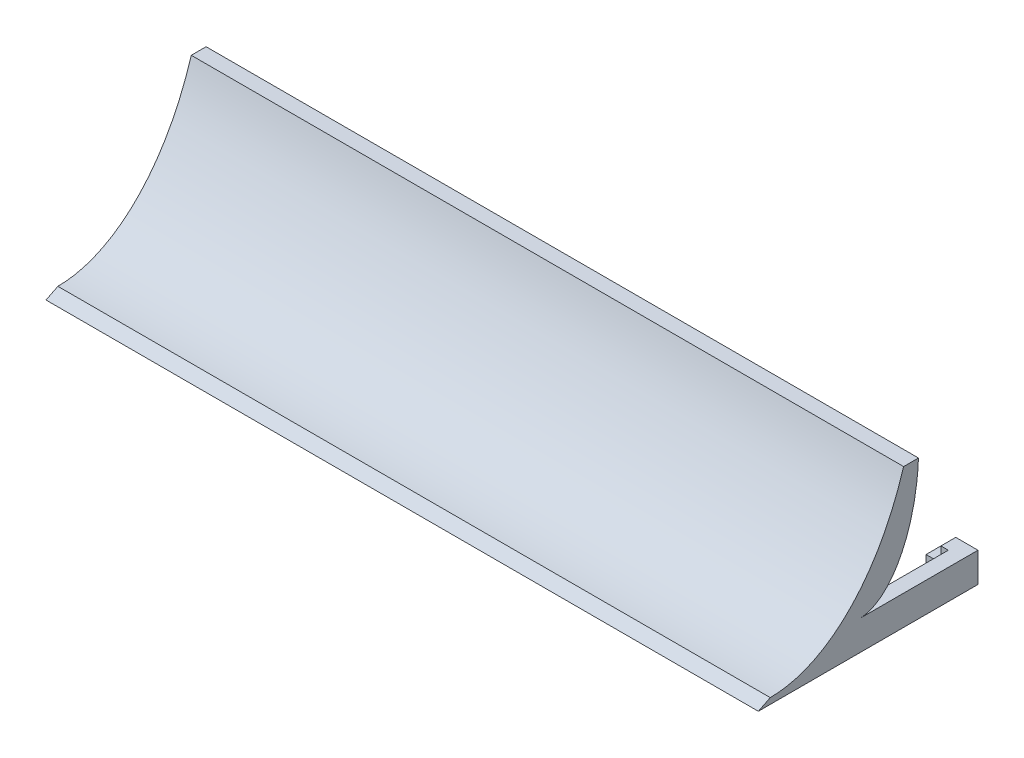
from build123d import *

# Parameters (mm, degrees)
CUCHILLA_SALIENTE_DEPTH                  = 60
CUCHILLA_SALIENTE_DEPTH_BACK             = 60
ENCAJE_CUCHILLA_LATERAL_CROQUIS_1_W      = 20
ENCAJE_CUCHILLA_LATERAL_CROQUIS_1_H      = 5
ENCAJE_CUCHILLA_LATERAL_SALIENTE_1_DEPTH = 2.5
ENCAJE_CUCHILLA_LATERAL_CROQUIS_2_W      = 20
ENCAJE_CUCHILLA_LATERAL_CROQUIS_2_H      = 2.5
ENCAJE_CUCHILLA_LATERAL_SALIENTE_2_DEPTH = 2.5
ENCAJE_CUCHILLA_LATERAL_CROQUIS_3_W      = 2.5
ENCAJE_CUCHILLA_LATERAL_CROQUIS_3_H      = 1.25
ENCAJE_CUCHILLA_LATERAL_SALIENTE_3_DEPTH = 1.25
ENCAJE_CUCHILLA_LATERAL_CROQUIS_4_W      = 2.5
ENCAJE_CUCHILLA_LATERAL_CROQUIS_4_H      = 1.25
ENCAJE_CUCHILLA_LATERAL_SALIENTE_4_DEPTH = 1.25
ENCAJE_CUCHILLA_LATERAL_CROQUIS_5_W      = 20
ENCAJE_CUCHILLA_LATERAL_CROQUIS_5_H      = 5
ENCAJE_CUCHILLA_LATERAL_SALIENTE_5_DEPTH = 2.5
ENCAJE_CUCHILLA_LATERAL_CROQUIS_6_W      = 20
ENCAJE_CUCHILLA_LATERAL_CROQUIS_6_H      = 2.5
ENCAJE_CUCHILLA_LATERAL_SALIENTE_6_DEPTH = 2.5
ENCAJE_CUCHILLA_LATERAL_CROQUIS_7_W      = 2.5
ENCAJE_CUCHILLA_LATERAL_CROQUIS_7_H      = 1.25
ENCAJE_CUCHILLA_LATERAL_SALIENTE_7_DEPTH = 1.25
ENCAJE_CUCHILLA_LATERAL_CROQUIS_8_W      = 2.5
ENCAJE_CUCHILLA_LATERAL_CROQUIS_8_H      = 1.25
ENCAJE_CUCHILLA_LATERAL_SALIENTE_8_DEPTH = 1.25
ENCAJE_CUCHILLA_CENTRAL_SALIENTE_DEPTH   = 20


with BuildPart() as part:
    # Croquis4 → Cuchilla-Saliente (new, two sides: drawn at the far end of the back side and taken through both)
    with BuildSketch(Plane(origin=(0, 0, 0), x_dir=(0, 0, -1), z_dir=(1, 0, 0)).offset(-CUCHILLA_SALIENTE_DEPTH_BACK)):
        with BuildLine():
            Line((9.97060468, 23.467626264), (7.47060468, 23.467626264))
            add(Edge.make_bspline(
                [(-15, 1), (0.62292895, 1), (7.47060468, 23.467626264)],
                knots=[0, 0, 0, 1.117079483, 1.117079483, 1.117079483], degree=2, weights=[1, 0.848029877, 1]))
            Line((-15, 1), (-17, 0))
            Line((-17, 0), (0, 0))
            Line((0, 0), (0, 5))
            add(Edge.make_bspline(
                [(0, 5), (9.261036245, 5), (9.97060468, 23.467626264)],
                knots=[0, 0, 0, 1.494102477, 1.494102477, 1.494102477], degree=2, weights=[1, 0.733695675, 1]))
        make_face()
    extrude(amount=CUCHILLA_SALIENTE_DEPTH + CUCHILLA_SALIENTE_DEPTH_BACK)

    # Encaje-Cuchilla-Lateral-Croquis-1 → Encaje-Cuchilla-Lateral-Saliente-1 (add)
    with BuildSketch(Plane(origin=(60, 0, 0), x_dir=(0, 0, -1), z_dir=(1, 0, 0))):
        with Locations((10, 2.5)):
            Rectangle(ENCAJE_CUCHILLA_LATERAL_CROQUIS_1_W, ENCAJE_CUCHILLA_LATERAL_CROQUIS_1_H)
    extrude(amount=-ENCAJE_CUCHILLA_LATERAL_SALIENTE_1_DEPTH)

    # Encaje-Cuchilla-Lateral-Croquis-2 → Encaje-Cuchilla-Lateral-Saliente-2 (add)
    with BuildSketch(Plane.ZY.offset(-57.5)):
        with Locations((-10, 1.25)):
            Rectangle(ENCAJE_CUCHILLA_LATERAL_CROQUIS_2_W, ENCAJE_CUCHILLA_LATERAL_CROQUIS_2_H)
    extrude(amount=ENCAJE_CUCHILLA_LATERAL_SALIENTE_2_DEPTH)

    # Encaje-Cuchilla-Lateral-Croquis-3 → Encaje-Cuchilla-Lateral-Saliente-3 (add)
    with BuildSketch(Plane.ZY.offset(-55)):
        with Locations((-18.75, 1.875)):
            Rectangle(ENCAJE_CUCHILLA_LATERAL_CROQUIS_3_W, ENCAJE_CUCHILLA_LATERAL_CROQUIS_3_H)
    extrude(amount=ENCAJE_CUCHILLA_LATERAL_SALIENTE_3_DEPTH)

    # Encaje-Cuchilla-Lateral-Croquis-4 → Encaje-Cuchilla-Lateral-Saliente-4 (add)
    with BuildSketch(Plane.ZY.offset(-57.5)):
        with Locations((-18.75, 4.375)):
            Rectangle(ENCAJE_CUCHILLA_LATERAL_CROQUIS_4_W, ENCAJE_CUCHILLA_LATERAL_CROQUIS_4_H)
    extrude(amount=ENCAJE_CUCHILLA_LATERAL_SALIENTE_4_DEPTH)



with BuildPart() as body_2:
    # Encaje-Cuchilla-Lateral-Croquis-5 → Encaje-Cuchilla-Lateral-Saliente-5 (new body)
    with BuildSketch(Plane.ZY.offset(60)):
        with Locations((-10, 2.5)):
            Rectangle(ENCAJE_CUCHILLA_LATERAL_CROQUIS_5_W, ENCAJE_CUCHILLA_LATERAL_CROQUIS_5_H)
    extrude(amount=-ENCAJE_CUCHILLA_LATERAL_SALIENTE_5_DEPTH)


with BuildPart() as part_1:
    add(part.part)

    add(body_2.part)  # Encaje-Cuchilla-Lateral-Saliente-6 merges body 2
    # Encaje-Cuchilla-Lateral-Croquis-6 → Encaje-Cuchilla-Lateral-Saliente-6 (add)
    with BuildSketch(Plane(origin=(-57.5, 0, 0), x_dir=(0, 0, -1), z_dir=(1, 0, 0))):
        with Locations((10, 1.25)):
            Rectangle(ENCAJE_CUCHILLA_LATERAL_CROQUIS_6_W, ENCAJE_CUCHILLA_LATERAL_CROQUIS_6_H)
    extrude(amount=ENCAJE_CUCHILLA_LATERAL_SALIENTE_6_DEPTH)

    # Encaje-Cuchilla-Lateral-Croquis-7 → Encaje-Cuchilla-Lateral-Saliente-7 (add)
    with BuildSketch(Plane(origin=(-57.5, 0, 0), x_dir=(0, 0, -1), z_dir=(1, 0, 0))):
        with Locations((18.75, 4.375)):
            Rectangle(ENCAJE_CUCHILLA_LATERAL_CROQUIS_7_W, ENCAJE_CUCHILLA_LATERAL_CROQUIS_7_H)
    extrude(amount=ENCAJE_CUCHILLA_LATERAL_SALIENTE_7_DEPTH)

    # Encaje-Cuchilla-Lateral-Croquis-8 → Encaje-Cuchilla-Lateral-Saliente-8 (add)
    with BuildSketch(Plane(origin=(-55, 0, 0), x_dir=(0, 0, -1), z_dir=(1, 0, 0))):
        with Locations((18.75, 1.875)):
            Rectangle(ENCAJE_CUCHILLA_LATERAL_CROQUIS_8_W, ENCAJE_CUCHILLA_LATERAL_CROQUIS_8_H)
    extrude(amount=ENCAJE_CUCHILLA_LATERAL_SALIENTE_8_DEPTH)

    # Encaje-Cuchilla-Central-Croquis → Encaje-Cuchilla-Central-Saliente (add)
    with BuildSketch(Plane(origin=(0, 0, 0), x_dir=(-1, 0, 0), z_dir=(0, 0, -1))):
        Polygon((2.5, 3.125), (5, 3.125), (5, 1.875), (2.5, 1.875), (2.5, 0), (-2.5, 0), (-2.5, 1.875), (-5, 1.875), (-5, 3.125), (-2.5, 3.125), (-2.5, 5), (2.5, 5), align=None)
    extrude(amount=ENCAJE_CUCHILLA_CENTRAL_SALIENTE_DEPTH)


solid = part_1.part
